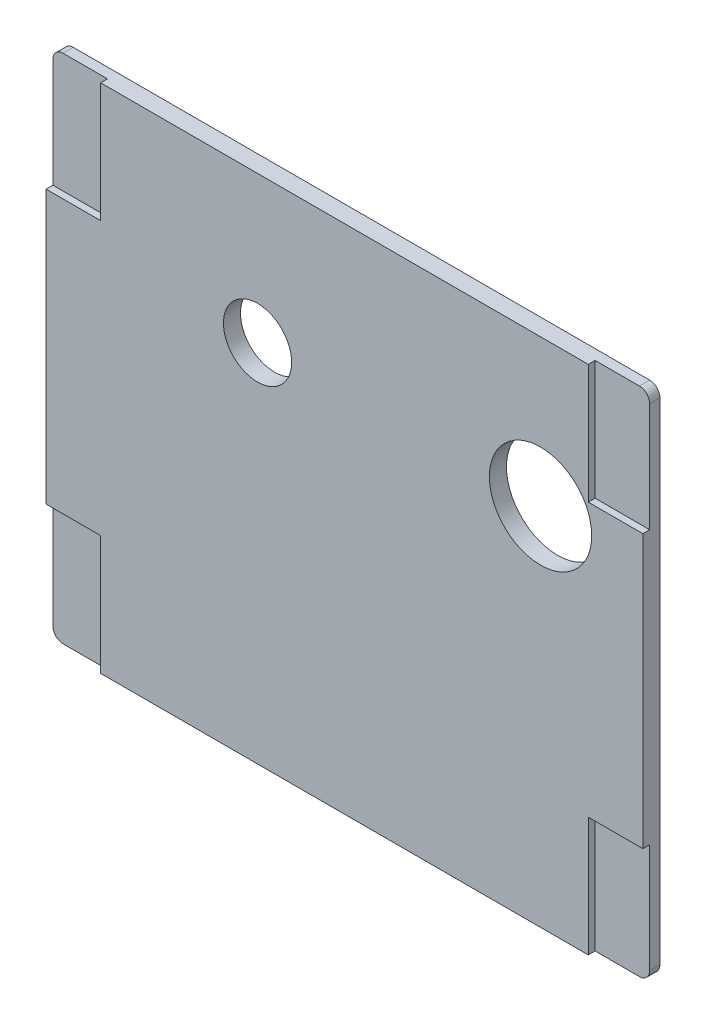
from build123d import *

# Parameters (mm, degrees)
SKETCH1_W           = 175
SKETCH1_H           = 150
BOSS_EXTRUDE1_DEPTH = 5
SKETCH3_R           = 15
SKETCH3_R_2         = 10
CUT_EXTRUDE1_DEPTH  = 5
SKETCH4_W           = 16
SKETCH4_H           = 35
CUT_EXTRUDE2_DEPTH  = 2
FILLET1_R           = 3


with BuildPart() as part:
    # Sketch1 → Boss-Extrude1 (new body)
    with BuildSketch(Plane.XY):
        with Locations((-87.5, -75)):
            Rectangle(SKETCH1_W, SKETCH1_H)
    extrude(amount=BOSS_EXTRUDE1_DEPTH)

    # Sketch3 → Cut-Extrude1 (cut)
    with BuildSketch(Plane.XY.offset(5)):
        with Locations((-30, -43)):
            Circle(SKETCH3_R)
        with Locations((-113, -43)):
            Circle(SKETCH3_R_2)
    extrude(amount=-CUT_EXTRUDE1_DEPTH, mode=Mode.SUBTRACT)

    # Sketch4 → Cut-Extrude2 (cut)
    with BuildSketch(Plane.XY.offset(5)):
        with Locations((-167, -17.5)):
            Rectangle(SKETCH4_W, SKETCH4_H)
        with Locations((-8, -17.5)):
            Rectangle(SKETCH4_W, SKETCH4_H)
        with Locations((-8, -132.5)):
            Rectangle(SKETCH4_W, SKETCH4_H)
        with Locations((-167, -132.5)):
            Rectangle(SKETCH4_W, SKETCH4_H)
    extrude(amount=-CUT_EXTRUDE2_DEPTH, mode=Mode.SUBTRACT)

    # Fillet1
    fillet1_edges = [part.edges().sort_by_distance(p)[0] for p in [
        (0, -150, 1.5),
        (-175, -150, 1.5),
        (-175, 0, 1.5),
        (0, 0, 1.5),
    ]]
    fillet(fillet1_edges, radius=FILLET1_R)


solid = part.part
